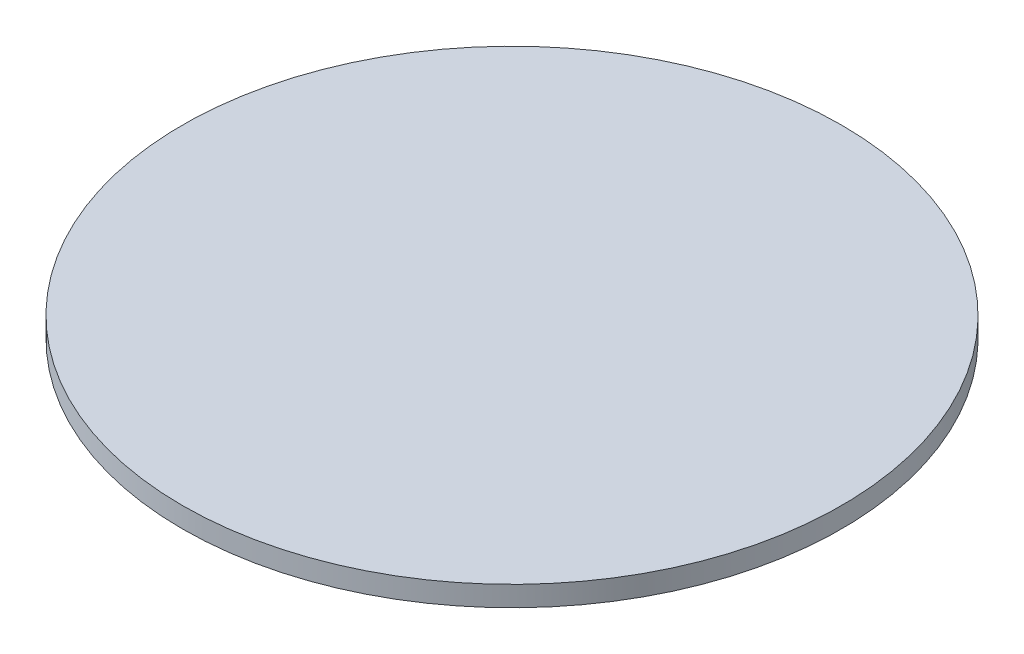
from build123d import *

# Parameters (mm, degrees)
SKETCH1_R           = 16.25
BOSS_EXTRUDE1_DEPTH = 1


with BuildPart() as part:
    # Sketch1 → Boss-Extrude1 (new body)
    with BuildSketch(Plane(origin=(0, 0, 0), x_dir=(1, 0, 0), z_dir=(0, 1, 0))):
        with Locations(Location((0, 0, 0), (0, 0, 270))):
            Circle(SKETCH1_R)
    extrude(amount=BOSS_EXTRUDE1_DEPTH)


solid = part.part
